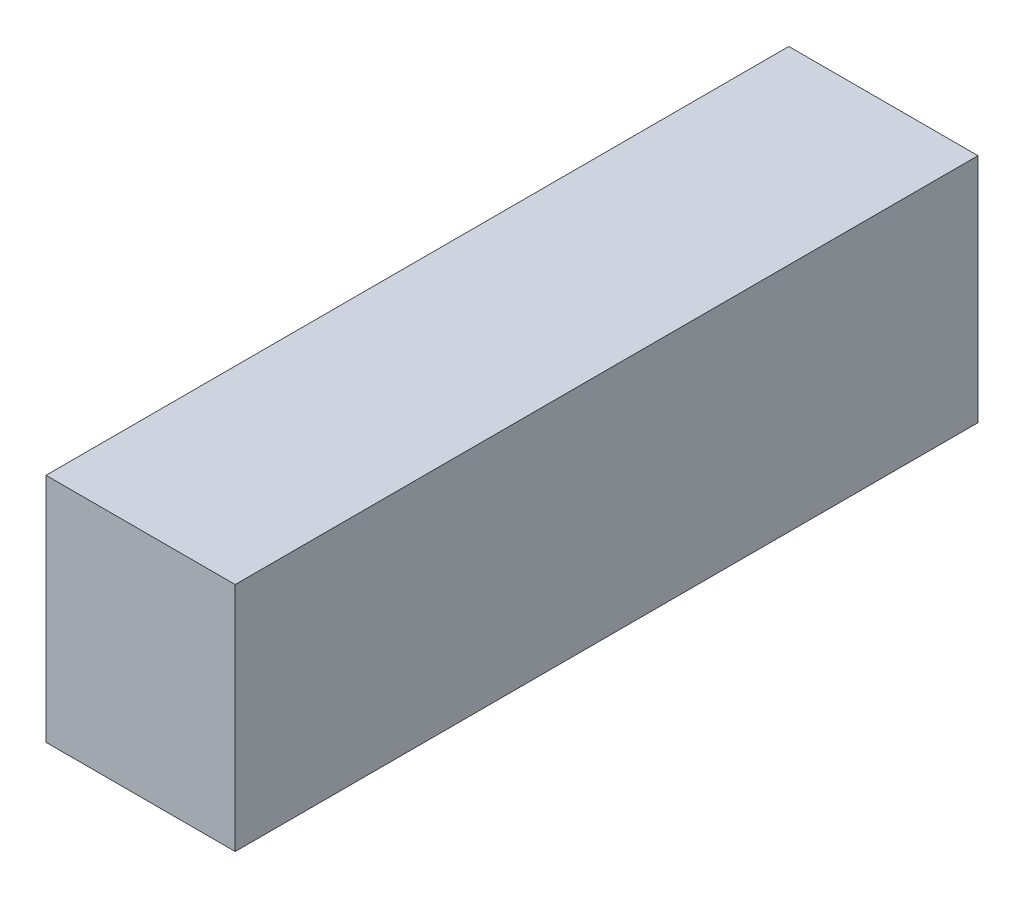
from build123d import *

# Parameters (mm, degrees)
SKETCH1_W           = 27
SKETCH1_H           = 106
BOSS_EXTRUDE1_DEPTH = 33


with BuildPart() as part:
    # Sketch1 → Boss-Extrude1 (new body)
    with BuildSketch(Plane.XZ.offset(15)):
        with Locations((-7.5, 83)):
            Rectangle(SKETCH1_W, SKETCH1_H)
    extrude(amount=-BOSS_EXTRUDE1_DEPTH)


solid = part.part
